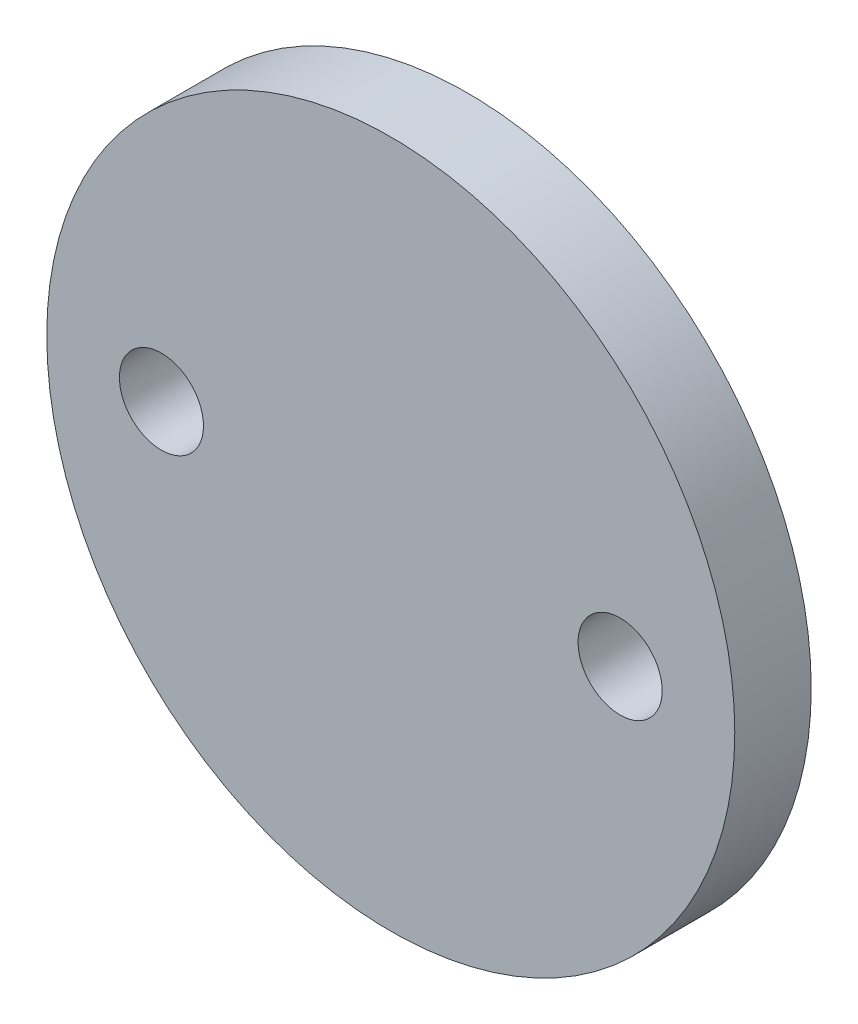
from build123d import *

# Parameters (mm, degrees)
SKETCH_1_R      = 9
SKETCH_1_R_2    = 1.1
EXTRUDE_1_DEPTH = 2


with BuildPart() as part:
    # 草图1 → 凸台-拉伸1 (new body)
    with BuildSketch(Plane.XY):
        with Locations((-8.8847886, 0)):
            Circle(SKETCH_1_R)
        with Locations((-14.8847886, 0)):
            Circle(SKETCH_1_R_2, mode=Mode.SUBTRACT)
        with Locations((-2.8847886, 0)):
            Circle(SKETCH_1_R_2, mode=Mode.SUBTRACT)
    extrude(amount=EXTRUDE_1_DEPTH)


solid = part.part
